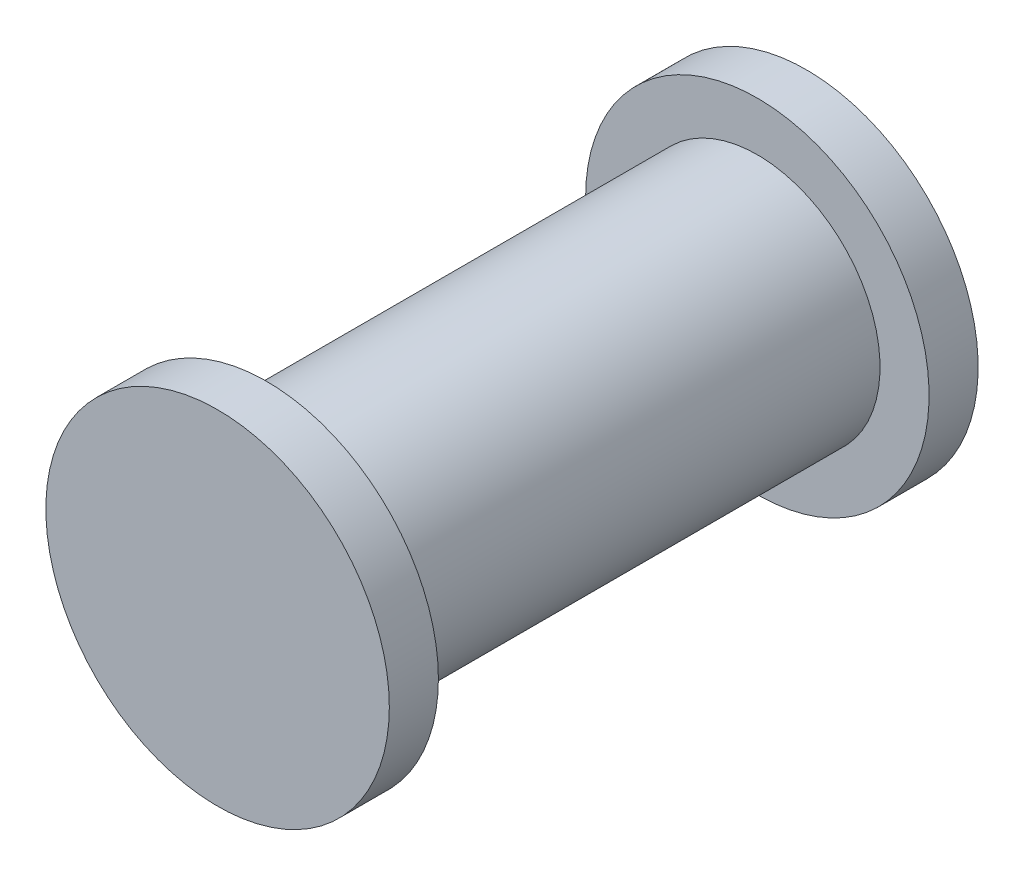
from build123d import *

# Parameters (mm, degrees)
SKETCH1_R           = 12.5
BOSS_EXTRUDE1_DEPTH = 50
SKETCH2_R           = 17.5
BOSS_EXTRUDE2_DEPTH = 5
BOSS_EXTRUDE3_START = 5
SKETCH3_R           = 17.5
BOSS_EXTRUDE3_DEPTH = 5


with BuildPart() as part:
    # Sketch1 → Boss-Extrude1 (new body)
    with BuildSketch(Plane.XY):
        Circle(SKETCH1_R)
    extrude(amount=BOSS_EXTRUDE1_DEPTH)

    # Sketch2 → Boss-Extrude2 (add)
    with BuildSketch(Plane.XY.offset(50)):
        Circle(SKETCH2_R)
    extrude(amount=BOSS_EXTRUDE2_DEPTH)

    # Sketch3 → Boss-Extrude3 (add)
    with BuildSketch(Plane(origin=(0, 0, 0), x_dir=(-1, 0, 0), z_dir=(0, 0, -1)).offset(BOSS_EXTRUDE3_START)):
        with Locations(Location((0, 0, 0), (0, 0, 180))):
            Circle(SKETCH3_R)
    extrude(amount=-BOSS_EXTRUDE3_DEPTH)


solid = part.part
